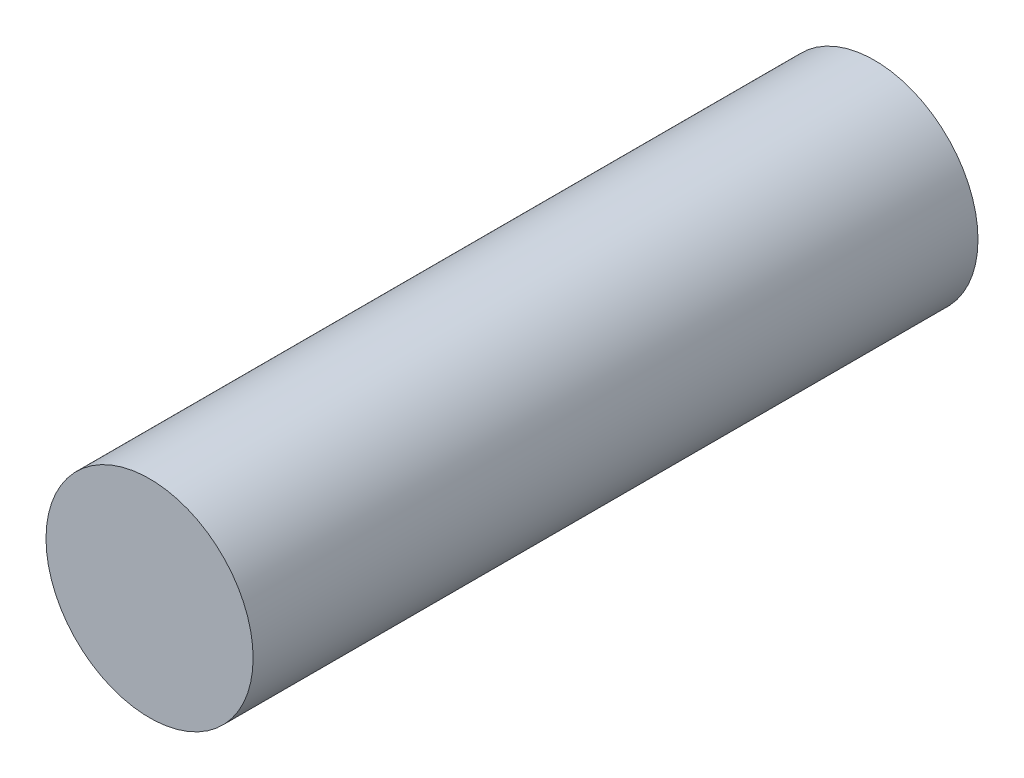
from build123d import *

# Parameters (mm, degrees)
SKETCH1_R           = 6.35
BOSS_EXTRUDE1_DEPTH = 44.45


with BuildPart() as part:
    # Sketch1 → Boss-Extrude1 (new body)
    with BuildSketch(Plane.XY):
        Circle(SKETCH1_R)
    extrude(amount=BOSS_EXTRUDE1_DEPTH)


solid = part.part
